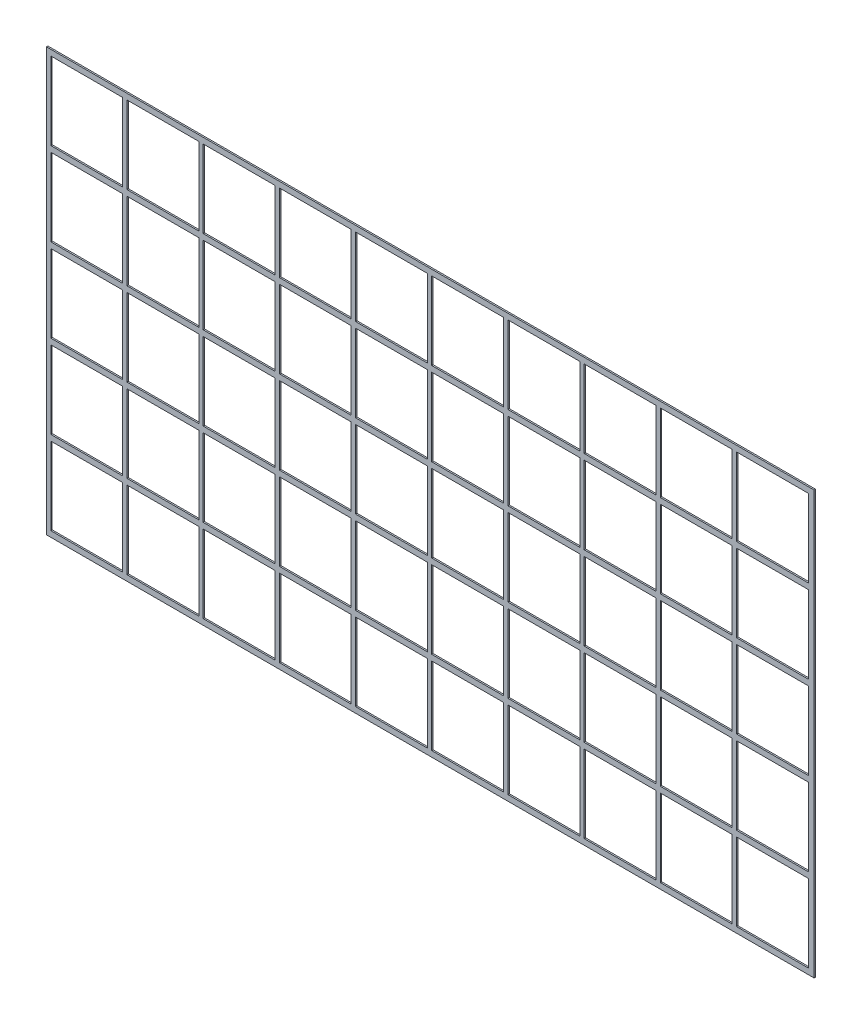
from build123d import *

# Parameters (mm, degrees)
SKETCH1_W           = 1695.45
SKETCH1_H           = 933.45
BOSS_EXTRUDE1_DEPTH = 3.175
SKETCH2_W           = 158.75
SKETCH2_H           = 171.45
CUT_EXTRUDE1_DEPTH  = 968.718958105


with BuildPart() as part:
    # Sketch1 → Boss-Extrude1 (new body)
    with BuildSketch(Plane.XY):
        Rectangle(SKETCH1_W, SKETCH1_H)
    extrude(amount=BOSS_EXTRUDE1_DEPTH)

    # Sketch2 → Cut-Extrude1 (cut, through all)
    with BuildSketch(Plane.XY.offset(3.175)):
        with Locations((-758.825, 368.3)):
            Rectangle(SKETCH2_W, SKETCH2_H)
        with Locations((-590.55, 368.3)):
            Rectangle(SKETCH2_W, SKETCH2_H)
        with Locations((-422.275, 368.3)):
            Rectangle(SKETCH2_W, SKETCH2_H)
        with Locations((-254, 368.3)):
            Rectangle(SKETCH2_W, SKETCH2_H)
        with Locations((-85.725, 368.3)):
            Rectangle(SKETCH2_W, SKETCH2_H)
        with Locations((82.55, 368.3)):
            Rectangle(SKETCH2_W, SKETCH2_H)
        with Locations((250.825, 368.3)):
            Rectangle(SKETCH2_W, SKETCH2_H)
        with Locations((419.1, 368.3)):
            Rectangle(SKETCH2_W, SKETCH2_H)
        with Locations((587.375, 368.3)):
            Rectangle(SKETCH2_W, SKETCH2_H)
        with Locations((755.65, 368.3)):
            Rectangle(SKETCH2_W, SKETCH2_H)
        with Locations((-590.55, 184.15)):
            Rectangle(SKETCH2_W, SKETCH2_H)
        with Locations((-422.275, 184.15)):
            Rectangle(SKETCH2_W, SKETCH2_H)
        with Locations((-254, 184.15)):
            Rectangle(SKETCH2_W, SKETCH2_H)
        with Locations((-85.725, 184.15)):
            Rectangle(SKETCH2_W, SKETCH2_H)
        with Locations((82.55, 184.15)):
            Rectangle(SKETCH2_W, SKETCH2_H)
        with Locations((250.825, 184.15)):
            Rectangle(SKETCH2_W, SKETCH2_H)
        with Locations((419.1, 184.15)):
            Rectangle(SKETCH2_W, SKETCH2_H)
        with Locations((587.375, 184.15)):
            Rectangle(SKETCH2_W, SKETCH2_H)
        with Locations((755.65, 184.15)):
            Rectangle(SKETCH2_W, SKETCH2_H)
        with Locations((-590.55, 0)):
            Rectangle(SKETCH2_W, SKETCH2_H)
        with Locations((-422.275, 0)):
            Rectangle(SKETCH2_W, SKETCH2_H)
        with Locations((-254, 0)):
            Rectangle(SKETCH2_W, SKETCH2_H)
        with Locations((-85.725, 0)):
            Rectangle(SKETCH2_W, SKETCH2_H)
        with Locations((82.55, 0)):
            Rectangle(SKETCH2_W, SKETCH2_H)
        with Locations((250.825, 0)):
            Rectangle(SKETCH2_W, SKETCH2_H)
        with Locations((419.1, 0)):
            Rectangle(SKETCH2_W, SKETCH2_H)
        with Locations((587.375, 0)):
            Rectangle(SKETCH2_W, SKETCH2_H)
        with Locations((755.65, 0)):
            Rectangle(SKETCH2_W, SKETCH2_H)
        with Locations((-590.55, -184.15)):
            Rectangle(SKETCH2_W, SKETCH2_H)
        with Locations((-422.275, -184.15)):
            Rectangle(SKETCH2_W, SKETCH2_H)
        with Locations((-254, -184.15)):
            Rectangle(SKETCH2_W, SKETCH2_H)
        with Locations((-85.725, -184.15)):
            Rectangle(SKETCH2_W, SKETCH2_H)
        with Locations((82.55, -184.15)):
            Rectangle(SKETCH2_W, SKETCH2_H)
        with Locations((250.825, -184.15)):
            Rectangle(SKETCH2_W, SKETCH2_H)
        with Locations((419.1, -184.15)):
            Rectangle(SKETCH2_W, SKETCH2_H)
        with Locations((587.375, -184.15)):
            Rectangle(SKETCH2_W, SKETCH2_H)
        with Locations((755.65, -184.15)):
            Rectangle(SKETCH2_W, SKETCH2_H)
        with Locations((-590.55, -368.3)):
            Rectangle(SKETCH2_W, SKETCH2_H)
        with Locations((-422.275, -368.3)):
            Rectangle(SKETCH2_W, SKETCH2_H)
        with Locations((-254, -368.3)):
            Rectangle(SKETCH2_W, SKETCH2_H)
        with Locations((-85.725, -368.3)):
            Rectangle(SKETCH2_W, SKETCH2_H)
        with Locations((82.55, -368.3)):
            Rectangle(SKETCH2_W, SKETCH2_H)
        with Locations((250.825, -368.3)):
            Rectangle(SKETCH2_W, SKETCH2_H)
        with Locations((419.1, -368.3)):
            Rectangle(SKETCH2_W, SKETCH2_H)
        with Locations((587.375, -368.3)):
            Rectangle(SKETCH2_W, SKETCH2_H)
        with Locations((755.65, -368.3)):
            Rectangle(SKETCH2_W, SKETCH2_H)
        with Locations((-758.825, 184.15)):
            Rectangle(SKETCH2_W, SKETCH2_H)
        with Locations((-758.825, 0)):
            Rectangle(SKETCH2_W, SKETCH2_H)
        with Locations((-758.825, -184.15)):
            Rectangle(SKETCH2_W, SKETCH2_H)
        with Locations((-758.825, -368.3)):
            Rectangle(SKETCH2_W, SKETCH2_H)
    extrude(amount=-CUT_EXTRUDE1_DEPTH, mode=Mode.SUBTRACT)


solid = part.part
